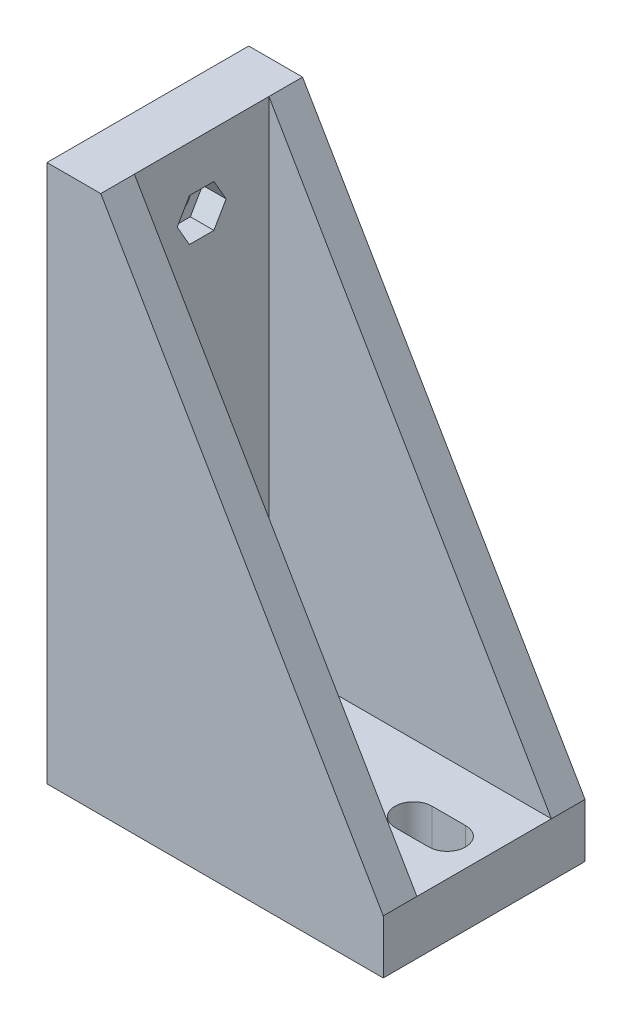
from build123d import *

# Parameters (mm, degrees)
BOSS_EXTRUDE1_DEPTH  = 15
RIB1_REACH           = 100.995
SKETCH2_WALL_W       = 283.344562668
SKETCH2_WALL_H       = 5
M3_CLEARANCE_HOLE1_D = 3.6
CUT_EXTRUDE2_DEPTH   = 3.5
CUT_EXTRUDE3_DEPTH   = 89.932558717


with BuildPart() as part:
    # Sketch1 → Boss-Extrude1 (new, symmetric)
    with BuildSketch(Plane.XY):
        Polygon((0, 0), (0, 80), (8, 80), (8, 8), (50, 8), (50, 0), align=None)
    extrude(amount=BOSS_EXTRUDE1_DEPTH, both=True)

    # Sketch2 wall → Rib1 (add, up to next)
    with BuildSketch(Plane(origin=(29, 44, 15), x_dir=(0.503871025524, -0.863778900898, 0), z_dir=(0.863778900898, 0.503871025524, 0)), mode=Mode.PRIVATE) as rib1_sk1:
        with Locations((0, 2.5)):
            Rectangle(SKETCH2_WALL_W, SKETCH2_WALL_H)
    rib1_tool1 = extrude(rib1_sk1.sketch, amount=-RIB1_REACH, mode=Mode.PRIVATE) - part.part
    rib1 = rib1_tool1.solids().sort_by_distance((29, 44, 15))[0]
    add(rib1)

    # Mirror1: Rib1 across plane
    add(rib1.mirror(Plane.XY))

    # M3 Clearance Hole1 (through all)
    with Locations(Plane(origin=(8, 0, 0), x_dir=(0, 0, -1), z_dir=(1, 0, 0))):
        with Locations((0, 70)):
            Hole(M3_CLEARANCE_HOLE1_D / 2)

    # Sketch6 → Cut-Extrude2 (cut)
    with BuildSketch(Plane(origin=(8, 0, 0), x_dir=(0, 0, -1), z_dir=(1, 0, 0))):
        Polygon((3.637306696, 70), (1.818653348, 73.15), (-1.818653348, 73.15), (-3.637306696, 70), (-1.818653348, 66.85), (1.818653348, 66.85), align=None)
    extrude(amount=-CUT_EXTRUDE2_DEPTH, mode=Mode.SUBTRACT)

    # Sketch7 → Cut-Extrude3 (cut, through all)
    with BuildSketch(Plane(origin=(0, 8, 0), x_dir=(1, 0, 0), z_dir=(0, 1, 0))):
        with BuildLine():
            Line((39.5, 2.75), (44.5, 2.75))
            ThreePointArc((44.5, 2.75), (47.25, 0), (44.5, -2.75))
            Line((44.5, -2.75), (39.5, -2.75))
            ThreePointArc((39.5, -2.75), (36.75, 0), (39.5, 2.75))
        make_face()
    extrude(amount=-CUT_EXTRUDE3_DEPTH, mode=Mode.SUBTRACT)


solid = part.part
